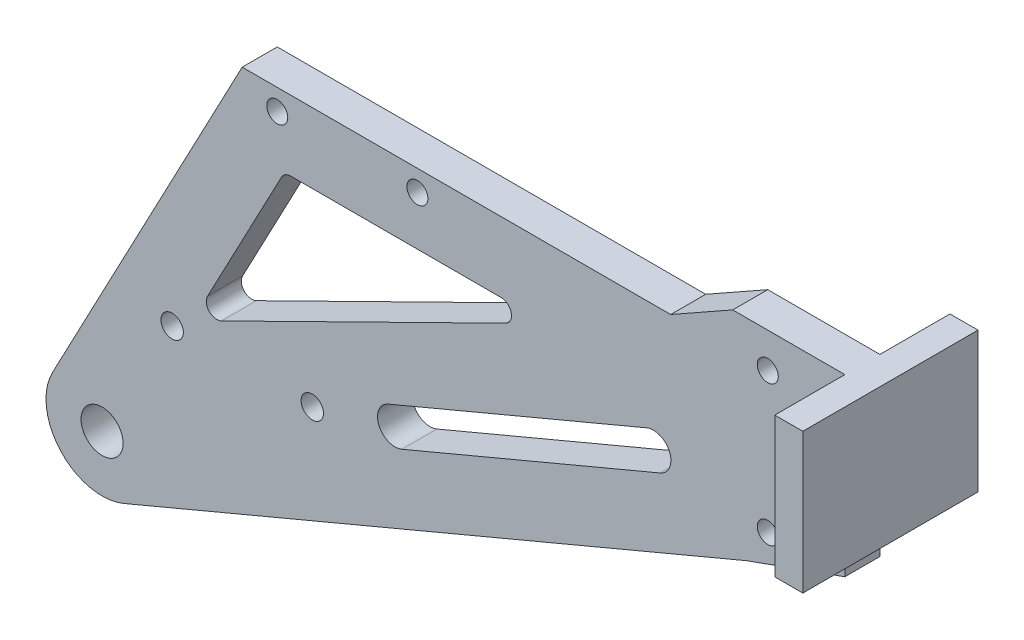
from build123d import *

# Parameters (mm, degrees)
SKETCH_1_R               = 3
SKETCH_1_R_2             = 1.5
EXTRUDE_1_DEPTH          = 5
EXTRUDE_2_DEPTH          = 5
SKETCH_4_R               = 1.5
CUT_EXTRUDE_1_DEPTH      = 144.265487819
EXTRUDE_START            = -5
EXTRUDE_3_DEPTH          = 5
CUT_EXTRUDE_2_DEPTH      = 144.265487819
SKETCH_7_R               = 1.6
CUT_EXTRUDE_3_DEPTH      = 144.265487819
EXTRUDE_4_DEPTH          = 24
CUT_EXTRUDE_4_DEPTH      = 10
CUT_EXTRUDE_4_DEPTH_BACK = 144.961800489
CUT_EXTRUDE_5_DEPTH      = 144.961800489
SKETCH_14_W              = 9.91097982
SKETCH_14_H              = 20
SKETCH_14_W_2            = 10.08902018
CUT_EXTRUDE_7_DEPTH      = 146.344418537


with BuildPart() as part:
    # 草图1 → 凸台-拉伸1 (new body)
    with BuildSketch(Plane.XY):
        with BuildLine():
            Line((-3.933140204, 6.966376973), (90, 60))
            Line((90, 60), (130, 60))
            Line((130, 60), (130, 30))
            Line((130, 30), (92, 30))
            Line((92, 30), (3.100465808, -7.374761811))
            ThreePointArc((3.100465808, -7.374761811), (-7.182645896, -3.522725923), (-3.933140204, 6.966376973))
        make_face()
        Circle(SKETCH_1_R, mode=Mode.SUBTRACT)
        with Locations((95, 55)):
            Circle(SKETCH_1_R_2, mode=Mode.SUBTRACT)
        with Locations((125, 55)):
            Circle(SKETCH_1_R_2, mode=Mode.SUBTRACT)
        with Locations((125, 35)):
            Circle(SKETCH_1_R_2, mode=Mode.SUBTRACT)
        with Locations((95, 35)):
            Circle(SKETCH_1_R_2, mode=Mode.SUBTRACT)
    extrude(amount=EXTRUDE_1_DEPTH)

    # 草图3 → 凸台-拉伸2 (add)
    with BuildSketch(Plane.XY.offset(5)):
        Polygon((81.144001216, 55), (20, 55), (20, 20.478766027), align=None)
    extrude(amount=-EXTRUDE_2_DEPTH)

    # 草图4 → 切除-拉伸1 (cut, through all)
    with BuildSketch(Plane.XY.offset(5)):
        with Locations((25, 52)):
            Circle(SKETCH_4_R)
        with Locations((45, 52)):
            Circle(SKETCH_4_R)
    extrude(amount=-CUT_EXTRUDE_1_DEPTH, mode=Mode.SUBTRACT)

    # 草图6 → 凸台-拉伸3 (add)
    with BuildSketch(Plane.XY.offset(5).offset(EXTRUDE_START)):
        with BuildLine():
            Line((-7.074049095, 3.736017853), (20, 55))
            Line((20, 55), (20, 20.478766027))
            Line((20, 20.478766027), (-3.933140204, 6.966376973))
            ThreePointArc((-3.933140204, 6.966376973), (-5.735709118, 5.576884517), (-7.074049095, 3.736017853))
        make_face()
    extrude(amount=EXTRUDE_3_DEPTH)

    # 草图5 → 切除-拉伸2 (cut, through all)
    with BuildSketch(Plane.XY.offset(5)):
        with BuildLine():
            Line((25.605401824, 44.200503347), (15.042800964, 24.200503347))
            ThreePointArc((15.042800964, 24.200503347), (15.293877797, 22.454192152), (17.032531201, 22.154647985))
            Line((17.032531201, 22.154647985), (57.595132061, 42.154647985))
            ThreePointArc((57.595132061, 42.154647985), (58.392612512, 43.840567158), (56.93178603, 45))
            Line((56.93178603, 45), (26.93178603, 45))
            ThreePointArc((26.93178603, 45), (26.157433081, 44.784670195), (25.605401824, 44.200503347))
        make_face()
    extrude(amount=-CUT_EXTRUDE_2_DEPTH, mode=Mode.SUBTRACT)

    # 草图7 → 切除-拉伸3 (cut, through all)
    with BuildSketch(Plane.XY.offset(5)):
        with Locations((10, 18)):
            Circle(SKETCH_7_R)
        with Locations((30, 18)):
            Circle(SKETCH_7_R)
    extrude(amount=-CUT_EXTRUDE_3_DEPTH, mode=Mode.SUBTRACT)

    # 草图8 → 凸台-拉伸4 (add)
    with BuildSketch(Plane(origin=(130, 0, 0), x_dir=(0, 0, -1), z_dir=(1, 0, 0))):
        Polygon((0, 30), (-5, 30), (-15, 30), (-15, 60), (10, 60), (10, 30), align=None)
    extrude(amount=-EXTRUDE_4_DEPTH)

    # 草图10 → 切除-拉伸4 (cut, two sides: drawn at the far end of the back side and taken through both)
    with BuildSketch(Plane.XY.offset(5).offset(-CUT_EXTRUDE_4_DEPTH_BACK)):
        Polygon((130, 30), (130, 40), (119.91097982, 40), (92, 30), align=None)
    extrude(amount=CUT_EXTRUDE_4_DEPTH + CUT_EXTRUDE_4_DEPTH_BACK, mode=Mode.SUBTRACT)

    # 草图12 → 切除-拉伸5 (cut, through all)
    with BuildSketch(Plane.XY.offset(5)):
        with BuildLine():
            Line((40.836799147, 23.774924451), (77.710608203, 39.277253491))
            ThreePointArc((77.710608203, 39.277253491), (80.984116834, 37.94153599), (79.648399333, 34.668027359))
            Line((79.648399333, 34.668027359), (42.774590277, 19.165698319))
            ThreePointArc((42.774590277, 19.165698319), (39.501081646, 20.50141582), (40.836799147, 23.774924451))
        make_face()
    extrude(amount=-CUT_EXTRUDE_5_DEPTH, mode=Mode.SUBTRACT)

    # 草图14 → 切除-拉伸7 (cut, through all)
    with BuildSketch(Plane.XY.offset(15)):
        Polygon((106, 35.015947161), (119.91097982, 40), (110, 40), (106, 40), align=None)
        with Locations((114.95548991, 50)):
            Rectangle(SKETCH_14_W, SKETCH_14_H)
        with Locations((124.95548991, 50)):
            Rectangle(SKETCH_14_W_2, SKETCH_14_H)
    extrude(amount=-CUT_EXTRUDE_7_DEPTH, mode=Mode.SUBTRACT)


solid = part.part
